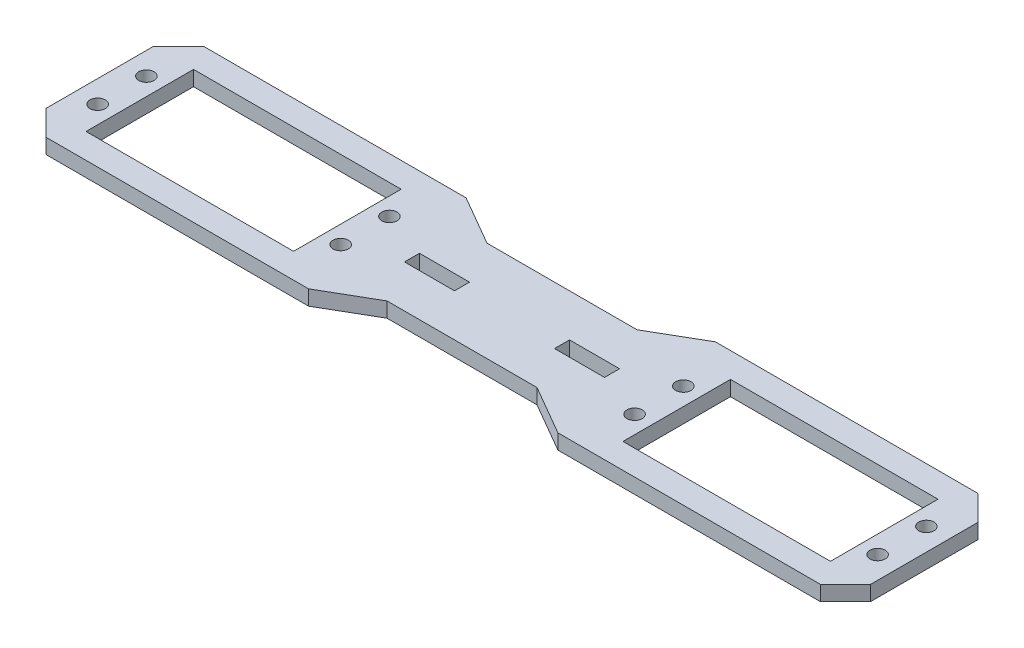
from build123d import *

# Parameters (mm, degrees)
SKETCH_1_R      = 1.525
SKETCH_1_W      = 41.5
SKETCH_1_H      = 21.5
SKETCH_1_W_2    = 10
SKETCH_1_H_2    = 3
EXTRUDE_1_DEPTH = 3


with BuildPart() as part:
    # 草图1 → 凸台-拉伸1 (new body)
    with BuildSketch(Plane(origin=(0, 0, 0), x_dir=(1, 0, 0), z_dir=(0, 1, 0))):
        Polygon((15, 10), (-15, 10), (-24.93, 15.75), (-77.43, 15.75), (-82.43, 10.75), (-82.43, -10.75), (-77.43, -15.75), (-24.93, -15.75), (-15, -10), (15, -10), (24.93, -15.75), (77.43, -15.75), (82.43, -10.75), (82.43, 10.75), (77.43, 15.75), (24.93, 15.75), align=None)
        with Locations(Location((-77.98, 4.875, 0), (0, 0, 270))):
            Circle(SKETCH_1_R, mode=Mode.SUBTRACT)
        with Locations(Location((-77.98, -4.875, 0), (0, 0, 90))):
            Circle(SKETCH_1_R, mode=Mode.SUBTRACT)
        with Locations(Location((77.98, -4.875, 0), (0, 0, 270))):
            Circle(SKETCH_1_R, mode=Mode.SUBTRACT)
        with Locations(Location((77.98, 4.875, 0), (0, 0, 90))):
            Circle(SKETCH_1_R, mode=Mode.SUBTRACT)
        with Locations(Location((-29.38, 4.875, 0), (0, 0, 270))):
            Circle(SKETCH_1_R, mode=Mode.SUBTRACT)
        with Locations(Location((-29.38, -4.875, 0), (0, 0, 90))):
            Circle(SKETCH_1_R, mode=Mode.SUBTRACT)
        with Locations(Location((29.38, -4.875, 0), (0, 0, 270))):
            Circle(SKETCH_1_R, mode=Mode.SUBTRACT)
        with Locations(Location((29.38, 4.875, 0), (0, 0, 90))):
            Circle(SKETCH_1_R, mode=Mode.SUBTRACT)
        with Locations((-53.68, 0)):
            Rectangle(SKETCH_1_W, SKETCH_1_H, mode=Mode.SUBTRACT)
        with Locations((-15, 0)):
            Rectangle(SKETCH_1_W_2, SKETCH_1_H_2, mode=Mode.SUBTRACT)
        with Locations((53.68, 0)):
            Rectangle(SKETCH_1_W, SKETCH_1_H, mode=Mode.SUBTRACT)
        with Locations((15, 0)):
            Rectangle(SKETCH_1_W_2, SKETCH_1_H_2, mode=Mode.SUBTRACT)
    extrude(amount=EXTRUDE_1_DEPTH)


solid = part.part
